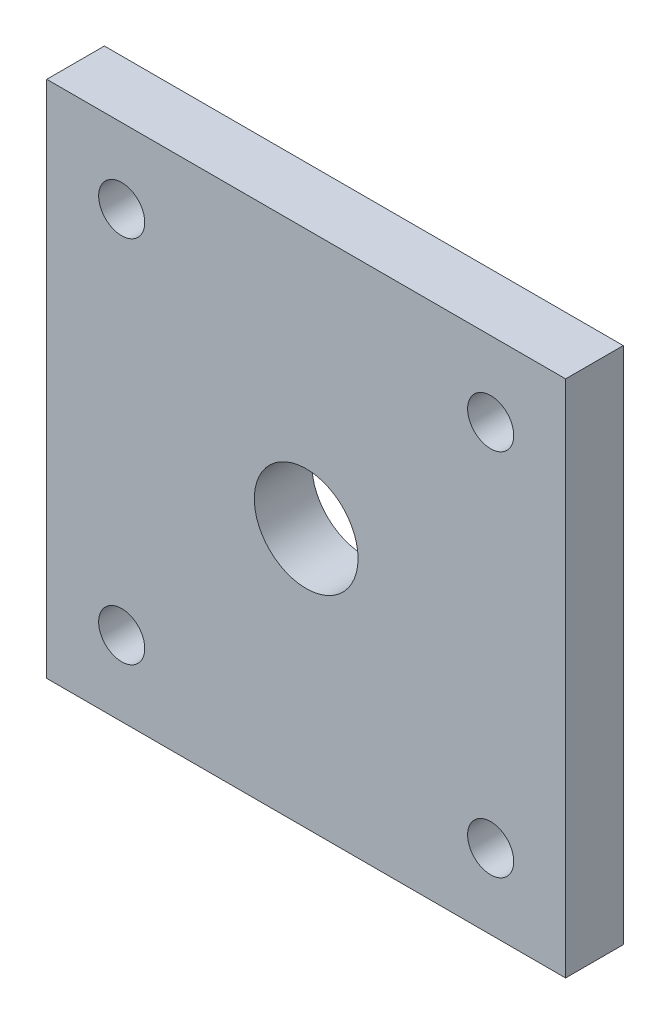
from build123d import *

# Parameters (mm, degrees)
SKETCH1_W           = 45
SKETCH1_H           = 45
SKETCH1_R           = 4.5
BOSS_EXTRUDE1_DEPTH = 5
CUT_EXTRUDE1_DEPTH  = 532.736885204


with BuildPart() as part:
    # Sketch1 → Boss-Extrude1 (new body)
    with BuildSketch(Plane.XY):
        Rectangle(SKETCH1_W, SKETCH1_H)
        Circle(SKETCH1_R, mode=Mode.SUBTRACT)
    extrude(amount=BOSS_EXTRUDE1_DEPTH)

    # Sketch2 → Cut-Extrude1 (cut, through all)
    with BuildSketch(Plane(origin=(-496.037536649, -95.134766003, 0), x_dir=(-1, 0, 0), z_dir=(0, 0, -1))):
        with BuildLine():
            ThreePointArc((-510.037536649, 79.134766003), (-512.037536649, 81.134766003), (-514.037536649, 79.134766003))
            ThreePointArc((-514.037536649, 79.134766003), (-512.037536649, 77.134766003), (-510.037536649, 79.134766003))
        make_face()
        with BuildLine():
            ThreePointArc((-478.037536649, 79.134766003), (-480.037536649, 81.134766003), (-482.037536649, 79.134766003))
            ThreePointArc((-482.037536649, 79.134766003), (-480.037536649, 77.134766003), (-478.037536649, 79.134766003))
        make_face()
        with BuildLine():
            ThreePointArc((-478.037536649, 111.134766003), (-480.037536649, 113.134766003), (-482.037536649, 111.134766003))
            ThreePointArc((-482.037536649, 111.134766003), (-480.037536649, 109.134766003), (-478.037536649, 111.134766003))
        make_face()
        with BuildLine():
            ThreePointArc((-510.037536649, 111.134766003), (-512.037536649, 113.134766003), (-514.037536649, 111.134766003))
            ThreePointArc((-514.037536649, 111.134766003), (-512.037536649, 109.134766003), (-510.037536649, 111.134766003))
        make_face()
    extrude(amount=-CUT_EXTRUDE1_DEPTH, mode=Mode.SUBTRACT)


solid = part.part
